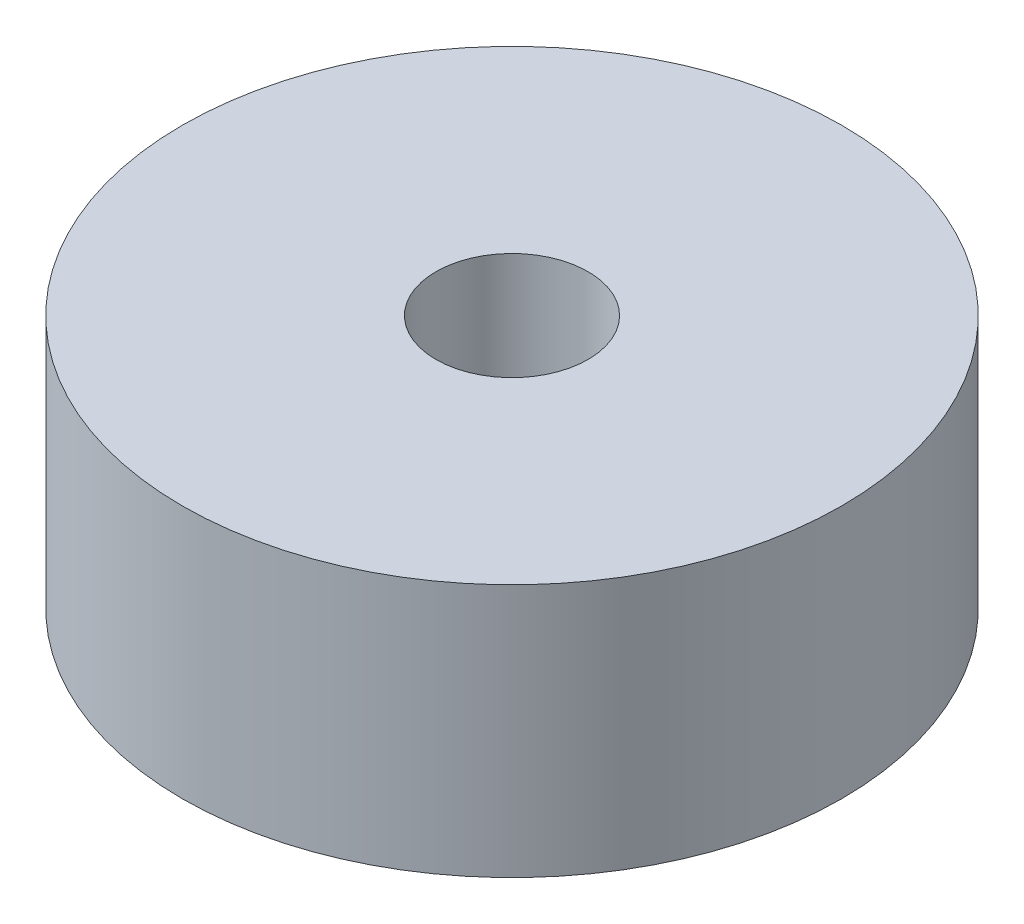
from build123d import *

# Parameters (mm, degrees)
SKETCH1_R           = 6.5
SKETCH1_R_2         = 1.5
BOSS_EXTRUDE1_DEPTH = 5


with BuildPart() as part:
    # Sketch1 → Boss-Extrude1 (new body)
    with BuildSketch(Plane(origin=(0, 0, 0), x_dir=(1, 0, 0), z_dir=(0, 1, 0))):
        with Locations(Location((0, 0, 0), (0, 0, 270))):
            Circle(SKETCH1_R)
        with Locations(Location((0, 0, 0), (0, 0, 270))):
            Circle(SKETCH1_R_2, mode=Mode.SUBTRACT)
    extrude(amount=BOSS_EXTRUDE1_DEPTH)


solid = part.part
